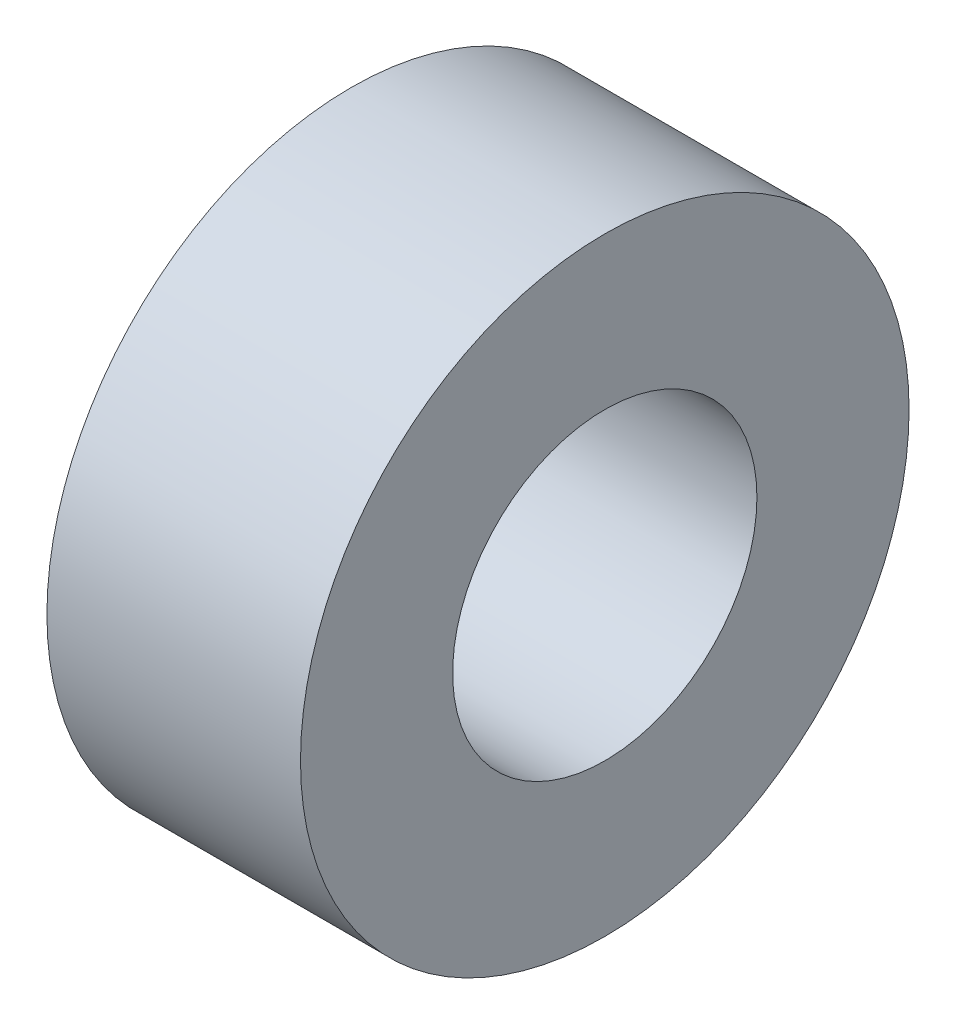
from build123d import *

# Parameters (mm, degrees)
SKETCH1_R           = 3
SKETCH1_R_2         = 1.5
BOSS_EXTRUDE1_DEPTH = 1.25


with BuildPart() as part:
    # Sketch1 → Boss-Extrude1 (new, symmetric)
    with BuildSketch(Plane(origin=(0, 0, 0), x_dir=(0, 0, -1), z_dir=(1, 0, 0))):
        Circle(SKETCH1_R)
        Circle(SKETCH1_R_2, mode=Mode.SUBTRACT)
    extrude(amount=BOSS_EXTRUDE1_DEPTH, both=True)


solid = part.part
